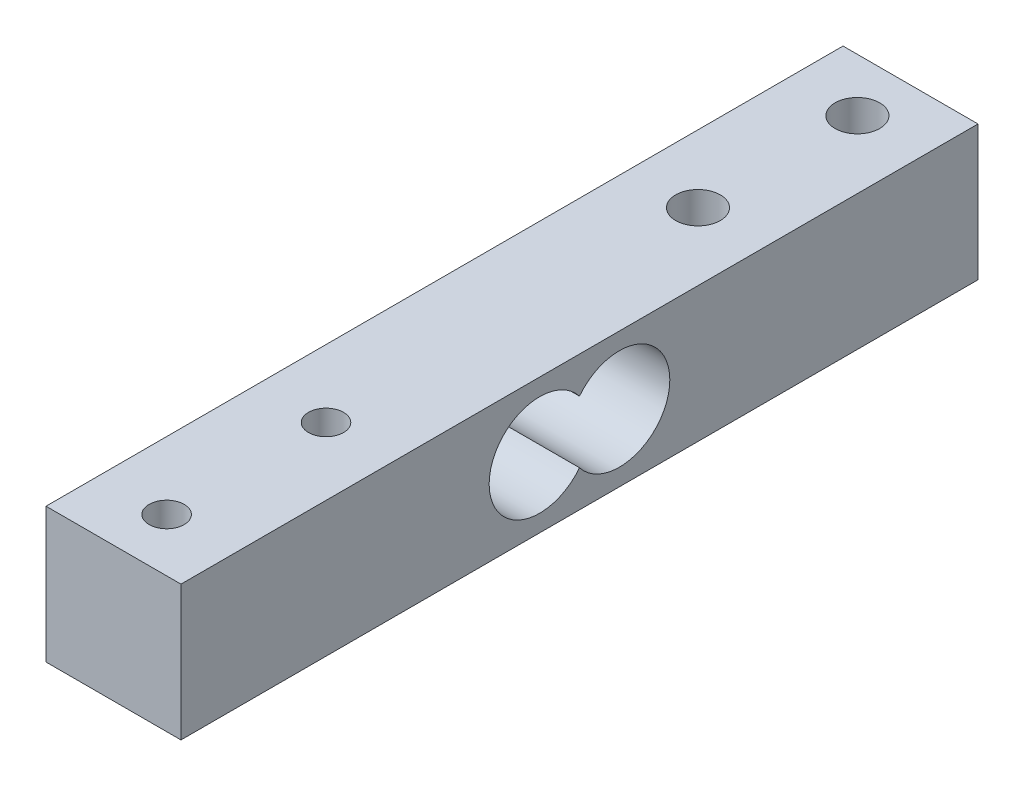
from build123d import *

# Parameters (mm, degrees)
SKETCH1_W                       = 12.7
SKETCH1_H                       = 75
BOSS_EXTRUDE1_DEPTH             = 6.35
TAP_DRILL_FOR_M4X0_7_TAP1_D     = 3.3
SKETCH7_R                       = 4.75
CUT_EXTRUDE1_DEPTH              = 41.098160806
TAP_DRILL_FOR_M5X0_8_TAP1_D     = 4.2
TAP_DRILL_FOR_M5X0_8_TAP1_DEPTH = 15
TAP_DRILL_FOR_M5X0_8_TAP1_TIP   = 1.2618073


with BuildPart() as part:
    # Sketch1 → Boss-Extrude1 (new, symmetric)
    with BuildSketch(Plane(origin=(0, 0, 0), x_dir=(1, 0, 0), z_dir=(0, 1, 0))):
        Rectangle(SKETCH1_W, SKETCH1_H)
    extrude(amount=BOSS_EXTRUDE1_DEPTH, both=True)

    # Tap Drill for M4x0.7 Tap1 (through all)
    with Locations(Plane(origin=(0, 6.35, 0), x_dir=(1, 0, 0), z_dir=(0, 1, 0))):
        with Locations((0, -32.5), (0, -17.5)):
            Hole(TAP_DRILL_FOR_M4X0_7_TAP1_D / 2)

    # Sketch7 → Cut-Extrude1 (cut, through all)
    with BuildSketch(Plane.ZY.offset(6.35)):
        with Locations((-3.75, 0)):
            Circle(SKETCH7_R)
        with Locations((3.75, 0)):
            Circle(SKETCH7_R)
    extrude(amount=-CUT_EXTRUDE1_DEPTH, mode=Mode.SUBTRACT)

    # Tap Drill for M5x0.8 Tap1
    with Locations(Plane(origin=(0, 6.35, 0), x_dir=(1, 0, 0), z_dir=(0, 1, 0))):
        with Locations((0, 17.5), (0, 32.5)):
            Hole(TAP_DRILL_FOR_M5X0_8_TAP1_D / 2, depth=TAP_DRILL_FOR_M5X0_8_TAP1_DEPTH)
            with Locations((0, 0, -(TAP_DRILL_FOR_M5X0_8_TAP1_DEPTH + TAP_DRILL_FOR_M5X0_8_TAP1_TIP / 2))):  # 118° drill point
                Cone(0, TAP_DRILL_FOR_M5X0_8_TAP1_D / 2, TAP_DRILL_FOR_M5X0_8_TAP1_TIP, mode=Mode.SUBTRACT)


solid = part.part
